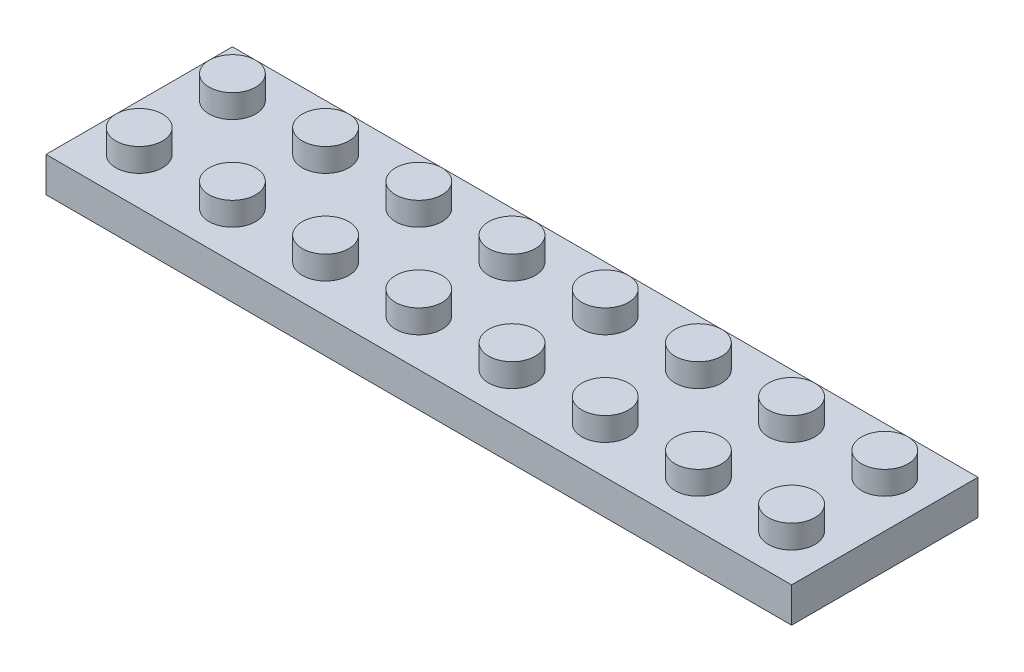
from build123d import *

# Parameters (mm, degrees)
SKETCH2_W           = 64
SKETCH2_H           = 16
BOSS_EXTRUDE1_DEPTH = 3
SKETCH3_R           = 2
BOSS_EXTRUDE2_DEPTH = 2
SHELL1_T            = -1
SKETCH4_R           = 2.8
SKETCH4_R_2         = 1.8
BOSS_EXTRUDE3_DEPTH = 2
LPATTERN2_COUNT     = 7
LPATTERN2_PITCH     = 8


with BuildPart() as part:
    # Sketch2 → Boss-Extrude1 (new body)
    with BuildSketch(Plane(origin=(0, 0, 0), x_dir=(1, 0, 0), z_dir=(0, 1, 0))):
        Rectangle(SKETCH2_W, SKETCH2_H)
    extrude(amount=BOSS_EXTRUDE1_DEPTH)

    # Sketch3 → Boss-Extrude2 (add)
    with BuildSketch(Plane(origin=(0, 3, 0), x_dir=(1, 0, 0), z_dir=(0, 1, 0))):
        with Locations(Location((-28, 4, 0), (0, 0, 270))):
            Circle(SKETCH3_R)
        with Locations(Location((-20, 4, 0), (0, 0, 270))):
            Circle(SKETCH3_R)
        with Locations(Location((-12, 4, 0), (0, 0, 270))):
            Circle(SKETCH3_R)
        with Locations(Location((-4, 4, 0), (0, 0, 270))):
            Circle(SKETCH3_R)
        with Locations(Location((4, 4, 0), (0, 0, 270))):
            Circle(SKETCH3_R)
        with Locations(Location((12, 4, 0), (0, 0, 270))):
            Circle(SKETCH3_R)
        with Locations(Location((20, 4, 0), (0, 0, 270))):
            Circle(SKETCH3_R)
        with Locations(Location((28, 4, 0), (0, 0, 270))):
            Circle(SKETCH3_R)
        with Locations(Location((-20, -4, 0), (0, 0, 270))):
            Circle(SKETCH3_R)
        with Locations(Location((-12, -4, 0), (0, 0, 270))):
            Circle(SKETCH3_R)
        with Locations(Location((-4, -4, 0), (0, 0, 270))):
            Circle(SKETCH3_R)
        with Locations(Location((4, -4, 0), (0, 0, 270))):
            Circle(SKETCH3_R)
        with Locations(Location((12, -4, 0), (0, 0, 270))):
            Circle(SKETCH3_R)
        with Locations(Location((20, -4, 0), (0, 0, 270))):
            Circle(SKETCH3_R)
        with Locations(Location((28, -4, 0), (0, 0, 270))):
            Circle(SKETCH3_R)
        with Locations(Location((-28, -4, 0), (0, 0, 270))):
            Circle(SKETCH3_R)
    extrude(amount=BOSS_EXTRUDE2_DEPTH)

    # Shell1
    shell1_openings = [part.faces().sort_by_distance(p)[0] for p in [
        (0, 0, 0),
    ]]
    offset(amount=SHELL1_T, openings=shell1_openings, kind=Kind.INTERSECTION)

    # Sketch4 → Boss-Extrude3 (add)
    with BuildSketch(Plane.XZ.offset(-2)):
        with Locations(Location((-24, 0, 0), (0, 0, 90))):
            Circle(SKETCH4_R)
        with Locations(Location((-24, 0, 0), (0, 0, 270))):
            Circle(SKETCH4_R_2, mode=Mode.SUBTRACT)
    boss_extrude3 = extrude(amount=BOSS_EXTRUDE3_DEPTH)

    # LPattern2: Boss-Extrude3 ×7
    with Locations(*[(i * LPATTERN2_PITCH, 0, 0) for i in range(1, LPATTERN2_COUNT)]):
        add(boss_extrude3)


solid = part.part
